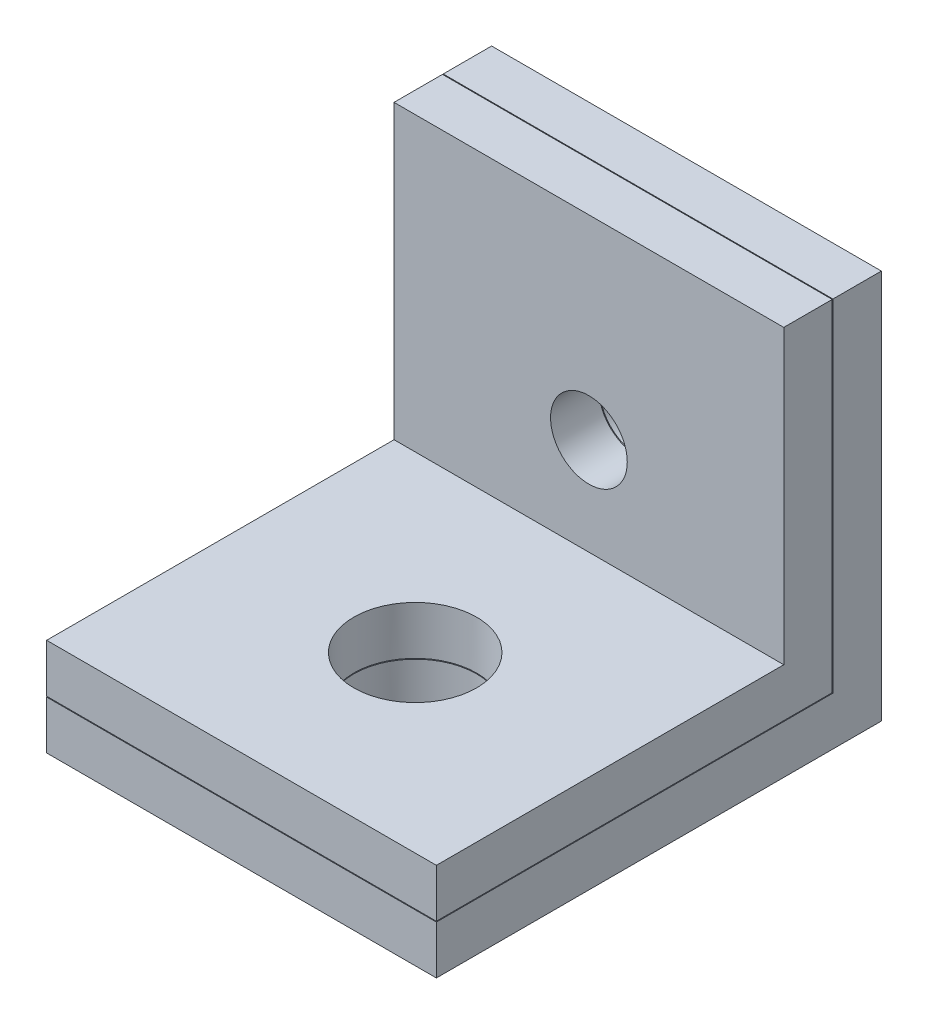
from build123d import *

# Parameters (mm, degrees)
SALIENTE_EXTRUIR1_DEPTH = 50.8
SALIENTE_EXTRUIR2_DEPTH = 50.8
CROQUIS3_R              = 8
CORTAR_EXTRUIR1_DEPTH   = 50.8
CROQUIS4_R              = 5
CORTAR_EXTRUIR2_DEPTH   = 24.525


with BuildPart() as part:
    # Croquis1 → Saliente-Extruir1 (new body)
    with BuildSketch(Plane(origin=(0, 0, 0), x_dir=(0, 0, -1), z_dir=(1, 0, 0))):
        Polygon((0, 0), (58, 0), (58, 50.8), (51.69, 50.8), (51.69, 6.31), (0, 6.31), align=None)
    extrude(amount=SALIENTE_EXTRUIR1_DEPTH)


with BuildPart() as body_2:
    # Croquis2 → Saliente-Extruir2 (new body)
    with BuildSketch(Plane.ZY):
        Polygon((-51.59, 50.8), (-51.59, 6.41), (0, 6.41), (0, 12.72), (-45.28, 12.72), (-45.28, 50.8), align=None)
    extrude(amount=-SALIENTE_EXTRUIR2_DEPTH)


with BuildPart() as cortar_extruir1_tool:
    # Croquis3 → Cortar-Extruir1 (new body)
    with BuildSketch(Plane(origin=(0, 12.72, 0), x_dir=(1, 0, 0), z_dir=(0, 1, 0))):
        with Locations(Location((25.4, 22.64, 0), (0, 0, 270))):
            Circle(CROQUIS3_R)
    extrude(amount=-CORTAR_EXTRUIR1_DEPTH)


with BuildPart() as part_1:
    add(part.part)

    # Cortar-Extruir1: cut by cortar_extruir1_tool
    add(cortar_extruir1_tool.part, mode=Mode.SUBTRACT)


with BuildPart() as body_2_1:
    add(body_2.part)

    # Cortar-Extruir1: cut by cortar_extruir1_tool
    add(cortar_extruir1_tool.part, mode=Mode.SUBTRACT)


with BuildPart() as cortar_extruir2_tool:
    # Croquis4 → Cortar-Extruir2 (new body)
    with BuildSketch(Plane(origin=(0, 0, -58), x_dir=(-1, 0, 0), z_dir=(0, 0, -1))):
        with Locations(Location((-25.4, 25.4, 0), (0, 0, 90))):
            Circle(CROQUIS4_R)
    extrude(amount=-CORTAR_EXTRUIR2_DEPTH)


with BuildPart() as part_2:
    add(part_1.part)

    # Cortar-Extruir2: cut by cortar_extruir2_tool
    add(cortar_extruir2_tool.part, mode=Mode.SUBTRACT)


with BuildPart() as body_2_2:
    add(body_2_1.part)

    # Cortar-Extruir2: cut by cortar_extruir2_tool
    add(cortar_extruir2_tool.part, mode=Mode.SUBTRACT)


solid = Compound([part_2.part, body_2_2.part])
